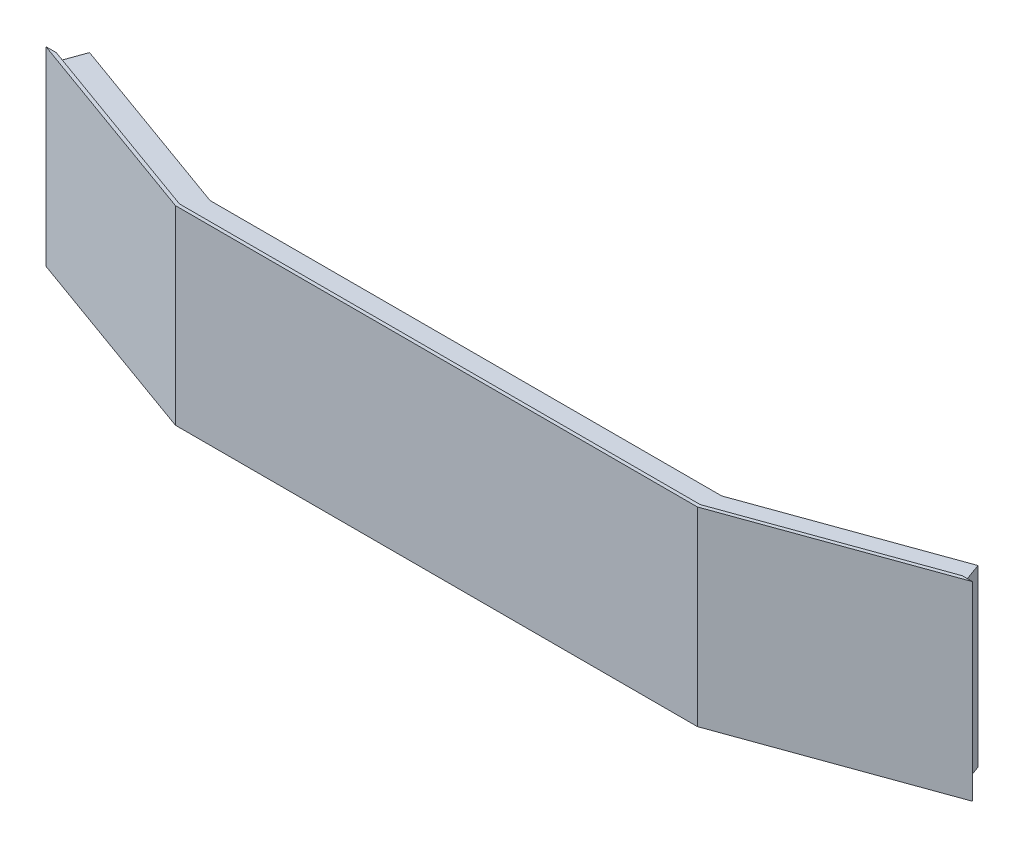
from build123d import *

# Parameters (mm, degrees)
BOSS_EXTRUDE1_DEPTH = 109.600000002
BOSS_EXTRUDE2_DEPTH = 2.54
BOSS_EXTRUDE3_DEPTH = 2.54
RIB2_REACH          = 442.308
SKETCH5_WALL_W      = 932.745237508
SKETCH5_WALL_H      = 2.54
RIB3_REACH          = 442.308
SKETCH6_WALL_W      = 932.745237508
SKETCH6_WALL_H      = 2.54
RIB4_REACH          = 442.308
SKETCH7_WALL_W      = 932.745237508
SKETCH7_WALL_H      = 2.54
RIB5_REACH          = 442.308
SKETCH8_WALL_W      = 932.745237508
SKETCH8_WALL_H      = 2.54
RIB6_REACH          = 332.895
SKETCH13_WALL_W     = 713.849927416
SKETCH13_WALL_H     = 2.54
RIB7_REACH          = 332.895
SKETCH14_WALL_W     = 713.849927416
SKETCH14_WALL_H     = 2.54
SKETCH15_W          = 2.54
SKETCH15_H          = 95.520000222
BOSS_EXTRUDE4_DEPTH = 15
SKETCH16_W          = 2.54
SKETCH16_H          = 95.520000222
BOSS_EXTRUDE5_DEPTH = 15


with BuildPart() as part:
    # Sketch1 → Boss-Extrude1 (new body)
    with BuildSketch(Plane(origin=(0, 0, 0), x_dir=(1, 0, 0), z_dir=(0, 1, 0))):
        Polygon((-261, -120), (-150, -160), (150, -160), (261, -120), (266.899364373, -120), (150.349364373, -162), (-150.349364373, -162), (-266.899364373, -120), align=None)
    extrude(amount=BOSS_EXTRUDE1_DEPTH)

    # Sketch2 → Boss-Extrude2 (add)
    with BuildSketch(Plane(origin=(0, 4.49999989, 0), x_dir=(1, 0, 0), z_dir=(0, 1, 0))):
        Polygon((147.379767206, -145), (255.914706381, -105.888310207), (261, -120), (150, -160), (-150, -160), (-261, -120), (-255.914706381, -105.888310207), (-147.379767206, -145), align=None)
    extrude(amount=BOSS_EXTRUDE2_DEPTH)

    # Sketch4 → Boss-Extrude3 (add)
    with BuildSketch(Plane(origin=(0, 105.100000112, 0), x_dir=(1, 0, 0), z_dir=(0, 1, 0))):
        Polygon((-255.914706381, -105.888310207), (-147.379767206, -145), (147.379767206, -145), (255.914706381, -105.888310207), (261, -120), (150, -160), (-150, -160), (-261, -120), align=None)
    extrude(amount=-BOSS_EXTRUDE3_DEPTH)

    # Sketch5 wall → Rib2 (add, up to next)
    with BuildSketch(Plane(origin=(-148.689883603, 78.680000057, 152.5), x_dir=(-0.052270147277, -0.952748261703, 0.299229980995), z_dir=(0.163945637159, -0.303761007739, -0.938536668561)), mode=Mode.PRIVATE) as rib2_sk1:
        Rectangle(SKETCH5_WALL_W, SKETCH5_WALL_H)
    rib2_tool1 = extrude(rib2_sk1.sketch, amount=-RIB2_REACH, mode=Mode.PRIVATE) - part.part
    add(rib2_tool1.solids().sort_by_distance((-148.689883603, 78.680000057, 152.5))[0])

    # Sketch6 wall → Rib3 (add, up to next)
    with BuildSketch(Plane(origin=(-148.689883603, 30.919999945, 152.5), x_dir=(0.052270147277, -0.952748261703, -0.299229980995), z_dir=(0.163945637159, 0.303761007739, -0.938536668561)), mode=Mode.PRIVATE) as rib3_sk1:
        Rectangle(SKETCH6_WALL_W, SKETCH6_WALL_H)
    rib3_tool1 = extrude(rib3_sk1.sketch, amount=-RIB3_REACH, mode=Mode.PRIVATE) - part.part
    add(rib3_tool1.solids().sort_by_distance((-148.689883603, 30.919999945, 152.5))[0])

    # Sketch7 wall → Rib4 (add, up to next)
    with BuildSketch(Plane(origin=(148.689883603, 78.680000057, 152.5), x_dir=(0.052270147277, -0.952748261703, 0.299229980995), z_dir=(-0.163945637159, -0.303761007739, -0.938536668561)), mode=Mode.PRIVATE) as rib4_sk1:
        Rectangle(SKETCH7_WALL_W, SKETCH7_WALL_H)
    rib4_tool1 = extrude(rib4_sk1.sketch, amount=-RIB4_REACH, mode=Mode.PRIVATE) - part.part
    add(rib4_tool1.solids().sort_by_distance((148.689883603, 78.680000057, 152.5))[0])

    # Sketch8 wall → Rib5 (add, up to next)
    with BuildSketch(Plane(origin=(148.689883603, 30.919999945, 152.5), x_dir=(-0.052270147277, -0.952748261703, -0.299229980995), z_dir=(-0.163945637159, 0.303761007739, -0.938536668561)), mode=Mode.PRIVATE) as rib5_sk1:
        Rectangle(SKETCH8_WALL_W, SKETCH8_WALL_H)
    rib5_tool1 = extrude(rib5_sk1.sketch, amount=-RIB5_REACH, mode=Mode.PRIVATE) - part.part
    add(rib5_tool1.solids().sort_by_distance((148.689883603, 30.919999945, 152.5))[0])

    # Sketch13 wall → Rib6 (add, up to next)
    with BuildSketch(Plane(origin=(0, 78.680000057, 152.5), x_dir=(0, -0.954052469095, 0.299639593869), z_dir=(0, -0.299639593869, -0.954052469095)), mode=Mode.PRIVATE) as rib6_sk1:
        Rectangle(SKETCH13_WALL_W, SKETCH13_WALL_H)
    rib6_tool1 = extrude(rib6_sk1.sketch, amount=-RIB6_REACH, mode=Mode.PRIVATE) - part.part
    add(rib6_tool1.solids().sort_by_distance((0, 78.680000057, 152.5))[0])

    # Sketch14 wall → Rib7 (add, up to next)
    with BuildSketch(Plane(origin=(0, 30.919999945, 152.5), x_dir=(0, -0.954052469095, -0.299639593869), z_dir=(0, 0.299639593869, -0.954052469095)), mode=Mode.PRIVATE) as rib7_sk1:
        Rectangle(SKETCH14_WALL_W, SKETCH14_WALL_H)
    rib7_tool1 = extrude(rib7_sk1.sketch, amount=-RIB7_REACH, mode=Mode.PRIVATE) - part.part
    add(rib7_tool1.solids().sort_by_distance((0, 30.919999945, 152.5))[0])

    # Sketch15 → Boss-Extrude4 (add)
    with BuildSketch(Plane(origin=(68.270957546, 0, 189.451907191), x_dir=(-0.9407793195201408, 0, 0.33901957460185245), z_dir=(-0.3390195746018524, 0, -0.9407793195201407))):
        with Locations((-203.591053443, 54.800000001)):
            Rectangle(SKETCH15_W, SKETCH15_H)
    extrude(amount=BOSS_EXTRUDE4_DEPTH)

    # Sketch16 → Boss-Extrude5 (add)
    with BuildSketch(Plane(origin=(-68.270957546, 0, 189.451907191), x_dir=(-0.9407793195201407, 0, -0.3390195746018526), z_dir=(0.3390195746018526, 0, -0.9407793195201408))):
        with Locations((203.591053443, 54.800000001)):
            Rectangle(SKETCH16_W, SKETCH16_H)
    extrude(amount=BOSS_EXTRUDE5_DEPTH)


solid = part.part
